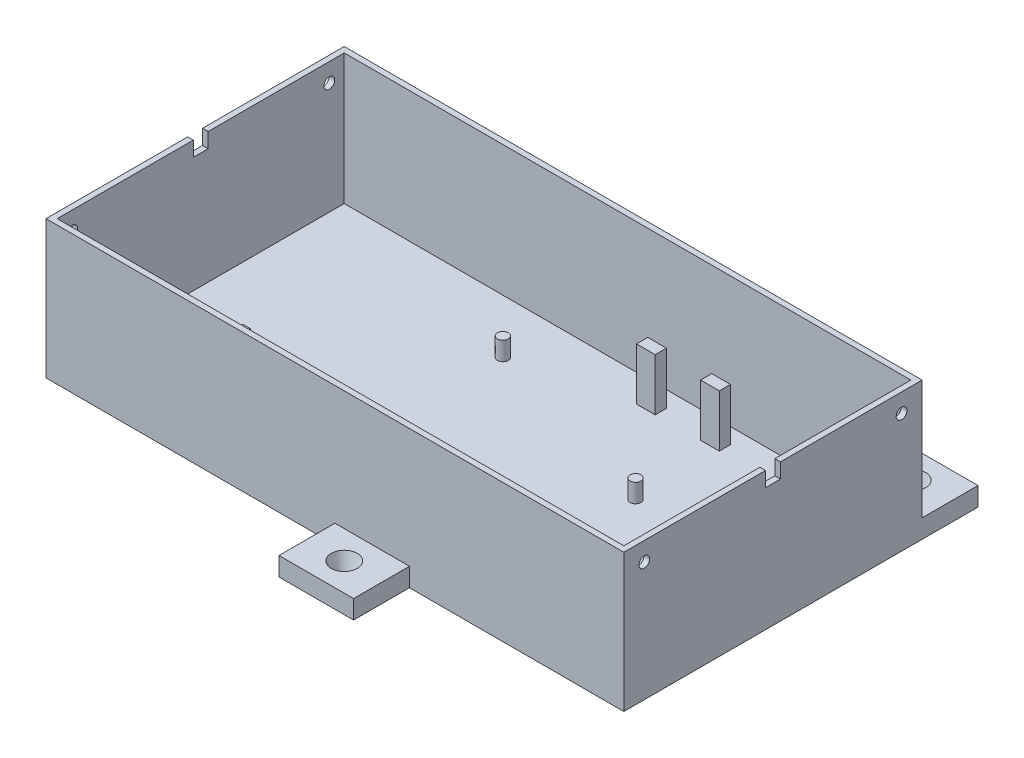
from build123d import *

# Parameters (mm, degrees)
SKETCH1_W            = 155
SKETCH1_H            = 80
BOSS_EXTRUDE1_DEPTH  = 2
SKETCH3_R            = 1.45
BOSS_EXTRUDE2_DEPTH  = 5
SKETCH4_W            = 5
SKETCH4_H            = 3
BOSS_EXTRUDE3_DEPTH  = 14
SKETCH5_W            = 5
SKETCH5_H            = 3
BOSS_EXTRUDE4_DEPTH  = 14
SKETCH6_W            = 10
SKETCH6_H            = 3
BOSS_EXTRUDE5_DEPTH  = 14
SKETCH7_W            = 2
SKETCH7_H            = 3
BOSS_EXTRUDE6_DEPTH  = 21
SKETCH8_W            = 155
SKETCH8_H            = 1.5
BOSS_EXTRUDE7_DEPTH  = 35
SKETCH9_W            = 155
SKETCH9_H            = 1.5
BOSS_EXTRUDE8_DEPTH  = 35
SKETCH10_W           = 1.5
SKETCH10_H           = 77
BOSS_EXTRUDE9_DEPTH  = 35
SKETCH11_W           = 1.5
SKETCH11_H           = 77
BOSS_EXTRUDE10_DEPTH = 35
SKETCH12_W           = 4
SKETCH12_H           = 8
CUT_EXTRUDE1_DEPTH   = 5
SKETCH13_W           = 4
SKETCH13_H           = 8
CUT_EXTRUDE2_DEPTH   = 5
SKETCH14_W           = 20
SKETCH14_H           = 5
BOSS_EXTRUDE11_DEPTH = 15
SKETCH15_W           = 20
SKETCH15_H           = 5
BOSS_EXTRUDE12_DEPTH = 15
SKETCH16_R           = 1.95
CUT_EXTRUDE3_DEPTH   = 5
SKETCH17_R           = 3.5
CUT_EXTRUDE4_DEPTH   = 10
CUT_EXTRUDE4_DRAFT   = -18
SKETCH18_R           = 1.95
CUT_EXTRUDE5_DEPTH   = 10
SKETCH19_R           = 3.5
CUT_EXTRUDE6_DEPTH   = 10
CUT_EXTRUDE6_DRAFT   = -18
SKETCH20_R           = 1.95
CUT_EXTRUDE7_DEPTH   = 10
SKETCH21_R           = 3.5
CUT_EXTRUDE8_DEPTH   = 10
CUT_EXTRUDE8_DRAFT   = -18
SKETCH22_R           = 1.45
CUT_EXTRUDE9_DEPTH   = 200
SKETCH23_R           = 1.45
CUT_EXTRUDE10_DEPTH  = 200


with BuildPart() as part:
    # Sketch1 → Boss-Extrude1 (new body)
    with BuildSketch(Plane(origin=(0, 0, 0), x_dir=(1, 0, 0), z_dir=(0, 1, 0))):
        Rectangle(SKETCH1_W, SKETCH1_H)
    extrude(amount=BOSS_EXTRUDE1_DEPTH)

    # Sketch3 → Boss-Extrude2 (add)
    with BuildSketch(Plane(origin=(0, 2, 0), x_dir=(1, 0, 0), z_dir=(0, 1, 0))):
        with Locations(Location((-20.3, -24.15, 0), (0, 0, 270))):
            Circle(SKETCH3_R)
        with Locations(Location((-19, 24.05, 0), (0, 0, 270))):
            Circle(SKETCH3_R)
        with Locations(Location((31.8, 8.85, 0), (0, 0, 270))):
            Circle(SKETCH3_R)
        with Locations(Location((31.8, -19.05, 0), (0, 0, 270))):
            Circle(SKETCH3_R)
    extrude(amount=BOSS_EXTRUDE2_DEPTH)

    # Sketch4 → Boss-Extrude3 (add)
    with BuildSketch(Plane(origin=(0, 2, 0), x_dir=(1, 0, 0), z_dir=(0, 1, 0))):
        with Locations((29.3, 32.8)):
            Rectangle(SKETCH4_W, SKETCH4_H)
    extrude(amount=BOSS_EXTRUDE3_DEPTH)

    # Sketch5 → Boss-Extrude4 (add)
    with BuildSketch(Plane(origin=(0, 2, 0), x_dir=(1, 0, 0), z_dir=(0, 1, 0))):
        with Locations((12.287448128, 32.618143972)):
            Rectangle(SKETCH5_W, SKETCH5_H)
    extrude(amount=BOSS_EXTRUDE4_DEPTH)

    # Sketch6 → Boss-Extrude5 (add)
    with BuildSketch(Plane(origin=(0, 2, 0), x_dir=(1, 0, 0), z_dir=(0, 1, 0))):
        with Locations((31.8, -30.5)):
            Rectangle(SKETCH6_W, SKETCH6_H)
    extrude(amount=BOSS_EXTRUDE5_DEPTH)

    # Sketch7 → Boss-Extrude6 (add)
    with BuildSketch(Plane(origin=(0, 2, 0), x_dir=(1, 0, 0), z_dir=(0, 1, 0))):
        with Locations((-39.555823147, -25.65)):
            Rectangle(SKETCH7_W, SKETCH7_H)
    extrude(amount=BOSS_EXTRUDE6_DEPTH)

    # Sketch8 → Boss-Extrude7 (add)
    with BuildSketch(Plane(origin=(0, 2, 0), x_dir=(1, 0, 0), z_dir=(0, 1, 0))):
        with Locations((0, 39.25)):
            Rectangle(SKETCH8_W, SKETCH8_H)
    extrude(amount=BOSS_EXTRUDE7_DEPTH)

    # Sketch9 → Boss-Extrude8 (add)
    with BuildSketch(Plane(origin=(0, 2, 0), x_dir=(1, 0, 0), z_dir=(0, 1, 0))):
        with Locations((0, -39.25)):
            Rectangle(SKETCH9_W, SKETCH9_H)
    extrude(amount=BOSS_EXTRUDE8_DEPTH)

    # Sketch10 → Boss-Extrude9 (add)
    with BuildSketch(Plane(origin=(0, 2, 0), x_dir=(1, 0, 0), z_dir=(0, 1, 0))):
        with Locations((76.75, 0)):
            Rectangle(SKETCH10_W, SKETCH10_H)
    extrude(amount=BOSS_EXTRUDE9_DEPTH)

    # Sketch11 → Boss-Extrude10 (add)
    with BuildSketch(Plane(origin=(0, 2, 0), x_dir=(1, 0, 0), z_dir=(0, 1, 0))):
        with Locations((-76.75, 0)):
            Rectangle(SKETCH11_W, SKETCH11_H)
    extrude(amount=BOSS_EXTRUDE10_DEPTH)

    # Sketch12 → Cut-Extrude1 (cut)
    with BuildSketch(Plane.ZY.offset(77.5)):
        with Locations((0, 37)):
            Rectangle(SKETCH12_W, SKETCH12_H)
    extrude(amount=-CUT_EXTRUDE1_DEPTH, mode=Mode.SUBTRACT)

    # Sketch13 → Cut-Extrude2 (cut)
    with BuildSketch(Plane(origin=(77.5, 0, 0), x_dir=(0, 0, -1), z_dir=(1, 0, 0))):
        with Locations((0, 37)):
            Rectangle(SKETCH13_W, SKETCH13_H)
    extrude(amount=-CUT_EXTRUDE2_DEPTH, mode=Mode.SUBTRACT)

    # Sketch14 → Boss-Extrude11 (add)
    with BuildSketch(Plane(origin=(0, 0, -40), x_dir=(-1, 0, 0), z_dir=(0, 0, -1))):
        with Locations((-67.5, 2.5)):
            Rectangle(SKETCH14_W, SKETCH14_H)
        with Locations((67.5, 2.5)):
            Rectangle(SKETCH14_W, SKETCH14_H)
    extrude(amount=BOSS_EXTRUDE11_DEPTH)

    # Sketch15 → Boss-Extrude12 (add)
    with BuildSketch(Plane.XY.offset(40)):
        with Locations((10, 2.5)):
            Rectangle(SKETCH15_W, SKETCH15_H)
    extrude(amount=BOSS_EXTRUDE12_DEPTH)

    # Sketch16 → Cut-Extrude3 (cut)
    with BuildSketch(Plane(origin=(0, 5, 0), x_dir=(1, 0, 0), z_dir=(0, 1, 0))):
        with Locations(Location((67.5, 47.5, 0), (0, 0, 270))):
            Circle(SKETCH16_R)
    extrude(amount=-CUT_EXTRUDE3_DEPTH, mode=Mode.SUBTRACT)


with BuildPart() as cut_extrude4_tool:
    # Sketch17 → Cut-Extrude4 (with draft: the straight prism first)
    with BuildSketch(Plane(origin=(0, 5, 0), x_dir=(1, 0, 0), z_dir=(0, 1, 0))):
        with Locations((67.5, 47.5)):
            Circle(SKETCH17_R)
    extrude(amount=-CUT_EXTRUDE4_DEPTH)
    # Cut-Extrude4: the draft: its side faces are tilted about the plane it starts from
    cut_extrude4_sides = [cut_extrude4_tool.faces().sort_by_distance(p)[0] for p in [
        (64, 0, -47.5),
    ]]
    draft(cut_extrude4_sides, Plane(origin=(0, 5, 0), x_dir=(1, 0, 0), z_dir=(0, 1, 0)), CUT_EXTRUDE4_DRAFT)


with BuildPart() as part_1:
    add(part.part)

    # Cut-Extrude4: cut by cut_extrude4_tool
    add(cut_extrude4_tool.part, mode=Mode.SUBTRACT)

    # Sketch18 → Cut-Extrude5 (cut)
    with BuildSketch(Plane(origin=(0, 5, 0), x_dir=(1, 0, 0), z_dir=(0, 1, 0))):
        with Locations(Location((-67.5, 47.5, 0), (0, 0, 180))):
            Circle(SKETCH18_R)
    extrude(amount=-CUT_EXTRUDE5_DEPTH, mode=Mode.SUBTRACT)


with BuildPart() as cut_extrude6_tool:
    # Sketch19 → Cut-Extrude6 (with draft: the straight prism first)
    with BuildSketch(Plane(origin=(0, 5, 0), x_dir=(1, 0, 0), z_dir=(0, 1, 0))):
        with Locations((-67.5, 47.5)):
            Circle(SKETCH19_R)
    extrude(amount=-CUT_EXTRUDE6_DEPTH)
    # Cut-Extrude6: the draft: its side faces are tilted about the plane it starts from
    cut_extrude6_sides = [cut_extrude6_tool.faces().sort_by_distance(p)[0] for p in [
        (-71, 0, -47.5),
    ]]
    draft(cut_extrude6_sides, Plane(origin=(0, 5, 0), x_dir=(1, 0, 0), z_dir=(0, 1, 0)), CUT_EXTRUDE6_DRAFT)


with BuildPart() as part_2:
    add(part_1.part)

    # Cut-Extrude6: cut by cut_extrude6_tool
    add(cut_extrude6_tool.part, mode=Mode.SUBTRACT)

    # Sketch20 → Cut-Extrude7 (cut)
    with BuildSketch(Plane(origin=(0, 5, 0), x_dir=(1, 0, 0), z_dir=(0, 1, 0))):
        with Locations(Location((10, -47.5, 0), (0, 0, 270))):
            Circle(SKETCH20_R)
    extrude(amount=-CUT_EXTRUDE7_DEPTH, mode=Mode.SUBTRACT)


with BuildPart() as cut_extrude8_tool:
    # Sketch21 → Cut-Extrude8 (with draft: the straight prism first)
    with BuildSketch(Plane(origin=(0, 5, 0), x_dir=(1, 0, 0), z_dir=(0, 1, 0))):
        with Locations((10, -47.5)):
            Circle(SKETCH21_R)
    extrude(amount=-CUT_EXTRUDE8_DEPTH)
    # Cut-Extrude8: the draft: its side faces are tilted about the plane it starts from
    cut_extrude8_sides = [cut_extrude8_tool.faces().sort_by_distance(p)[0] for p in [
        (6.5, 0, 47.5),
    ]]
    draft(cut_extrude8_sides, Plane(origin=(0, 5, 0), x_dir=(1, 0, 0), z_dir=(0, 1, 0)), CUT_EXTRUDE8_DRAFT)


with BuildPart() as part_3:
    add(part_2.part)

    # Cut-Extrude8: cut by cut_extrude8_tool
    add(cut_extrude8_tool.part, mode=Mode.SUBTRACT)

    # Sketch22 → Cut-Extrude9 (cut)
    with BuildSketch(Plane(origin=(77.5, 0, 0), x_dir=(0, 0, -1), z_dir=(1, 0, 0))):
        with Locations((-34.5, 32)):
            Circle(SKETCH22_R)
    extrude(amount=-CUT_EXTRUDE9_DEPTH, mode=Mode.SUBTRACT)

    # Sketch23 → Cut-Extrude10 (cut)
    with BuildSketch(Plane(origin=(77.5, 0, 0), x_dir=(0, 0, -1), z_dir=(1, 0, 0))):
        with Locations((34.5, 32)):
            Circle(SKETCH23_R)
    extrude(amount=-CUT_EXTRUDE10_DEPTH, mode=Mode.SUBTRACT)


solid = part_3.part
